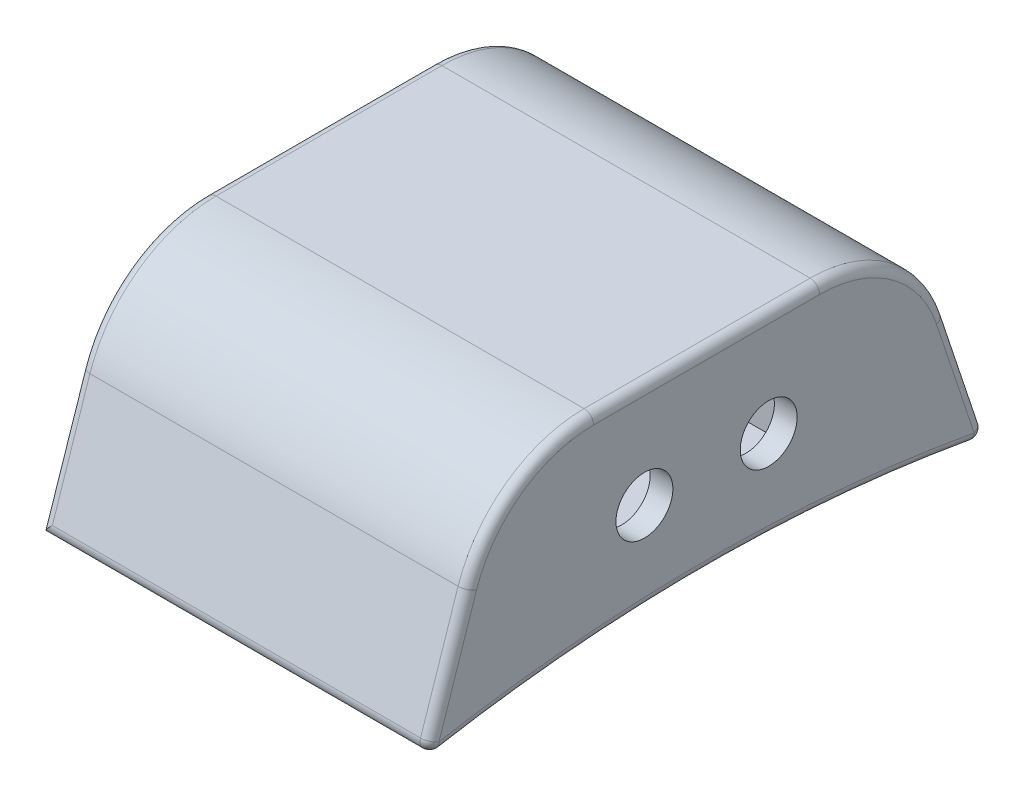
from build123d import *
from OCP.BRepFilletAPI import BRepFilletAPI_MakeChamfer

# Parameters (mm, degrees)
BOSS_EXTRUDE1_DEPTH             = 9.2
BOSS_EXTRUDE1_DEPTH_BACK        = 10
SKETCH1_W                       = 13.1
SKETCH1_H                       = 6.6
SKETCH2_W                       = 13.1
SKETCH2_H                       = 6.6
SKETCH2_R                       = 1.5
SKETCH2_W_2                     = 6.55
BOSS_EXTRUDE2_DEPTH             = 1.2
CUT_EXTRUDE1_DEPTH              = 20.4
FILLET1_R                       = 7
BOSS_EXTRUDE3_REACH             = 28.189
BOSS_EXTRUDE3_END_RADIUS        = 80
SKETCH4_R                       = 1.5
BOSS_EXTRUDE3_DIRECTION_2_DEPTH = 1
SKETCH5_R                       = 1.4
CUT_EXTRUDE2_DEPTH              = 7
CHAMFER1_SIZE                   = 0.25
CHAMFER1_SIZE2                  = 1.417820455
FILLET2_R                       = 0.5


with BuildPart() as part:
    # Sketch1 → Boss-Extrude1 (new, two sides: drawn at the far end of the back side and taken through both)
    with BuildSketch(Plane(origin=(0, 0, 0), x_dir=(0, 0, -1), z_dir=(1, 0, 0)).offset(-BOSS_EXTRUDE1_DEPTH_BACK)):
        Polygon((-8.75, -4), (-4.75, 8), (17.25, 8), (21.25, -4), align=None)
        with Locations((6.25, 2.5)):
            Rectangle(SKETCH1_W, SKETCH1_H, mode=Mode.SUBTRACT)
    extrude(amount=BOSS_EXTRUDE1_DEPTH + BOSS_EXTRUDE1_DEPTH_BACK)

    # Sketch2 → Boss-Extrude2 (add)
    # profile 1 of 3: a face of its own
    with BuildSketch(Plane(origin=(9.2, 0, 0), x_dir=(0, 0, -1), z_dir=(1, 0, 0))):
        Polygon((-4.75, 8), (-8.75, -4), (21.25, -4), (17.25, 8), align=None)
        with Locations((6.25, 2.5)):
            Rectangle(SKETCH2_W, SKETCH2_H, mode=Mode.SUBTRACT)
    # profile 2 of 3: a face of its own
    with BuildSketch(Plane(origin=(9.2, 0, 0), x_dir=(0, 0, -1), z_dir=(1, 0, 0))):
        with Locations((6.25, 2.5)):
            Rectangle(SKETCH2_W, SKETCH2_H)
        with Locations((2.975, 2.5)):
            Circle(SKETCH2_R, mode=Mode.SUBTRACT)
        with Locations((9.525, 2.5)):
            Circle(SKETCH2_R, mode=Mode.SUBTRACT)
    # profile 3 of 3: a face of its own
    with BuildSketch(Plane(origin=(9.2, 0, 0), x_dir=(0, 0, -1), z_dir=(1, 0, 0))):
        with Locations((9.525, 2.5)):
            Rectangle(SKETCH2_W_2, SKETCH2_H)
        with Locations((9.525, 2.5)):
            Circle(SKETCH2_R, mode=Mode.SUBTRACT)
    extrude(amount=BOSS_EXTRUDE2_DEPTH)

    # Sketch3 → Cut-Extrude1 (cut)
    with BuildSketch(Plane(origin=(10.4, 0, 0), x_dir=(0, 0, -1), z_dir=(1, 0, 0))):
        with BuildLine():
            Line((21.091886117, -3.525658351), (21.25, -4))
            Line((21.25, -4), (-8.75, -4))
            Line((-8.75, -4), (-8.591886117, -3.525658351))
            ThreePointArc((-8.591886117, -3.525658351), (6.25, -2.136843411), (21.091886117, -3.525658351))
        make_face()
    extrude(amount=-CUT_EXTRUDE1_DEPTH, mode=Mode.SUBTRACT)

    # Fillet1
    fillet1_edges = [part.edges().sort_by_distance(p)[0] for p in [
        (0.2, 8, 4.75),
        (0.2, 8, -17.25),
    ]]
    fillet(fillet1_edges, radius=FILLET1_R)

    # Boss-Extrude3: up to this cylinder (the profile starts inside it)
    boss_extrude3_end = Plane(origin=(3.4, -82.136843411, -6.25), z_dir=(1, 0, 0)) * Cylinder(BOSS_EXTRUDE3_END_RADIUS, 217.378, mode=Mode.PRIVATE)
    # Sketch4 → Boss-Extrude3 (add, up to the surface)
    with BuildSketch(Plane(origin=(0, -3.525658351, 0), x_dir=(1, 0, 0), z_dir=(0, 1, 0)), mode=Mode.PRIVATE) as boss_extrude3_sk1:
        with Locations(Location((3.4, 13.8, 0), (0, 0, 270))):
            Circle(SKETCH4_R)
    boss_extrude3_tool1 = extrude(boss_extrude3_sk1.sketch, amount=BOSS_EXTRUDE3_REACH, mode=Mode.PRIVATE) & boss_extrude3_end
    add(boss_extrude3_tool1.solids().sort_by_distance((3.4, -3.525658, -13.8))[0])
    # Sketch4 → Boss-Extrude3 (add, up to the surface)
    with BuildSketch(Plane(origin=(0, -3.525658351, 0), x_dir=(1, 0, 0), z_dir=(0, 1, 0)), mode=Mode.PRIVATE) as boss_extrude3_sk2:
        with Locations(Location((3.4, -1.3, 0), (0, 0, 270))):
            Circle(SKETCH4_R)
    boss_extrude3_tool2 = extrude(boss_extrude3_sk2.sketch, amount=BOSS_EXTRUDE3_REACH, mode=Mode.PRIVATE) & boss_extrude3_end
    add(boss_extrude3_tool2.solids().sort_by_distance((3.4, -3.525658, 1.3))[0])

    # Sketch4 → Boss-Extrude3 direction 2 (add)
    with BuildSketch(Plane(origin=(0, -3.525658351, 0), x_dir=(1, 0, 0), z_dir=(0, 1, 0))):
        with Locations(Location((3.4, 13.8, 0), (0, 0, 270))):
            Circle(SKETCH4_R)
        with Locations(Location((3.4, -1.3, 0), (0, 0, 270))):
            Circle(SKETCH4_R)
    extrude(amount=-BOSS_EXTRUDE3_DIRECTION_2_DEPTH)

    # Sketch5 → Cut-Extrude2 (cut)
    with BuildSketch(Plane(origin=(0, -3.525658351, 0), x_dir=(1, 0, 0), z_dir=(0, 1, 0))):
        with Locations(Location((-7.1, 16.25, 0), (0, 0, 90))):
            Circle(SKETCH5_R)
        with Locations(Location((-7.1, -3.75, 0), (0, 0, 90))):
            Circle(SKETCH5_R)
    extrude(amount=CUT_EXTRUDE2_DEPTH, mode=Mode.SUBTRACT)

    # Chamfer1: one chamfer whose edges measure the first distance from different faces: ONE call of the kernel's chamfer builder (chamfer() names one face for all edges)
    chamfer1_edges_1 = [part.edges().sort_by_distance(p)[0] for p in [
        (3.4, -4.525658351, -0.2),
    ]]
    chamfer1_side_1 = [part.faces().sort_by_distance(p)[0] for p in [
        (3.4, -4.525658351, 1.3),
    ]]
    chamfer1_edges_2 = [part.edges().sort_by_distance(p)[0] for p in [
        (3.4, -4.525658351, -15.3),
    ]]
    chamfer1_side_2 = [part.faces().sort_by_distance(p)[0] for p in [
        (3.4, -4.525658351, -13.8),
    ]]
    chamfer1 = BRepFilletAPI_MakeChamfer(part.part.solid().wrapped)
    for e in chamfer1_edges_1:
        chamfer1.Add(CHAMFER1_SIZE, CHAMFER1_SIZE2, e.wrapped, chamfer1_side_1[0].wrapped)  # the first distance lies on this face
    for e in chamfer1_edges_2:
        chamfer1.Add(CHAMFER1_SIZE, CHAMFER1_SIZE2, e.wrapped, chamfer1_side_2[0].wrapped)  # the first distance lies on this face
    add(Compound.cast(chamfer1.Shape()), mode=Mode.REPLACE)

    # Fillet2
    fillet2_edges = [part.edges().sort_by_distance(p)[0] for p in [
        (10.4, -0.156031994, -19.968677331),
        (-10, -0.156031994, -19.968677331),
        (10.4, -2.136843411, -6.25),
        (0.2, -3.525658351, -21.091886117),
        (0.2, -3.525658351, 8.591886117),
        (10.4, 8, -6.25),
        (10.4, -0.156031994, 7.468677331),
        (10.4, 6.678695296, 3.797657452),
        (10.4, 6.678695296, -16.297657452),
        (-10, 8, -6.25),
        (-10, -0.156031994, 7.468677331),
        (-10, 6.678695296, 3.797657452),
        (-10, 6.678695296, -16.297657452),
    ]]
    fillet(fillet2_edges, radius=FILLET2_R)


solid = part.part
